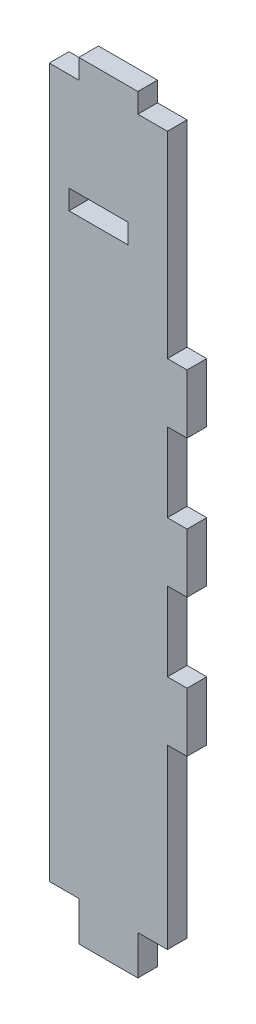
from build123d import *

# Parameters (mm, degrees)
SKETCH1_W           = 15
SKETCH1_H           = 5
BOSS_EXTRUDE1_DEPTH = 2.5


with BuildPart() as part:
    # Sketch1 → Boss-Extrude1 (new, symmetric)
    with BuildSketch(Plane.XY):
        Polygon((430, 300), (430, 255), (422.5, 255), (422.5, 245), (407.5, 245), (407.5, 255), (400, 255), (400, 435), (407.5, 435), (407.5, 440), (422.5, 440), (422.5, 435), (430, 435), (430, 385), (435, 385), (435, 370), (430, 370), (430, 350), (435, 350), (435, 335), (430, 335), (430, 315), (435, 315), (435, 300), align=None)
        with Locations((412.5, 407.5)):
            Rectangle(SKETCH1_W, SKETCH1_H, mode=Mode.SUBTRACT)
    extrude(amount=BOSS_EXTRUDE1_DEPTH, both=True)


solid = part.part
